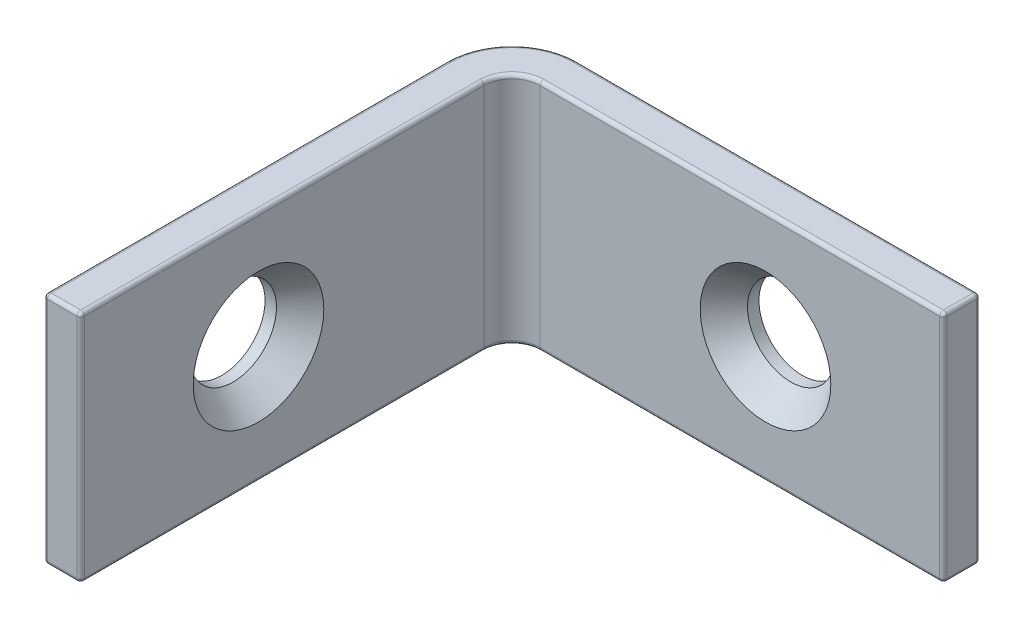
from build123d import *

# Parameters (mm, degrees)
BOSS_EXTRUDE1_DEPTH = 6.35
FILLET1_R           = 1.524
FILLET2_R           = 3.5179
CUT_EXTRUDE1_REACH  = 36.405
SKETCH4_R           = 2.3495
CUT_EXTRUDE3_REACH  = 36.405
SKETCH6_R           = 2.3495
FILLET3_R           = 0.19939


with BuildPart() as part:
    # Sketch3 → Boss-Extrude1 (new, symmetric)
    with BuildSketch(Plane(origin=(0, 0, 0), x_dir=(1, 0, 0), z_dir=(0, 1, 0))):
        Polygon((0.99695, -24.40305), (-0.99695, -24.40305), (-0.99695, 0.99695), (24.40305, 0.99695), (24.40305, -0.99695), (0.99695, -0.99695), align=None)
    extrude(amount=BOSS_EXTRUDE1_DEPTH, both=True)

    # Fillet1
    fillet1_edges = [part.edges().sort_by_distance(p)[0] for p in [
        (0.99695, 0, 0.99695),
    ]]
    fillet(fillet1_edges, radius=FILLET1_R)

    # Fillet2
    fillet2_edges = [part.edges().sort_by_distance(p)[0] for p in [
        (-0.99695, 0, -0.99695),
    ]]
    fillet(fillet2_edges, radius=FILLET2_R)

    # Sketch4 → Cut-Extrude1 (cut, up to next)
    with BuildSketch(Plane.XY.offset(0.99695), mode=Mode.PRIVATE) as cut_extrude1_sk1:
        with Locations((14.75105, 0)):
            Circle(SKETCH4_R)
    cut_extrude1_tool1 = extrude(cut_extrude1_sk1.sketch, amount=-CUT_EXTRUDE1_REACH, mode=Mode.PRIVATE) & part.part
    add(cut_extrude1_tool1.solids().sort_by_distance((14.75105, 0, 0.99695))[0], mode=Mode.SUBTRACT)

    # Cut-Extrude2 cone 1 section (through the dimple's axis) → Cut-Extrude2 (revolve, cut)
    with BuildSketch(Plane(origin=(14.75105, 0, 0.99695), x_dir=(0, -1, 0), z_dir=(1, 0, 0))):
        Polygon((0, 0), (3.5433, 0), (0, 4.076100377), align=None)
    revolve(axis=Axis((14.75105, 0, 0.99695), (0, 0, -1)), mode=Mode.SUBTRACT)

    # Sketch6 → Cut-Extrude3 (cut, up to next)
    with BuildSketch(Plane(origin=(0.99695, 0, 0), x_dir=(0, 0, -1), z_dir=(1, 0, 0)), mode=Mode.PRIVATE) as cut_extrude3_sk1:
        with Locations((-14.75105, 0)):
            Circle(SKETCH6_R)
    cut_extrude3_tool1 = extrude(cut_extrude3_sk1.sketch, amount=-CUT_EXTRUDE3_REACH, mode=Mode.PRIVATE) & part.part
    add(cut_extrude3_tool1.solids().sort_by_distance((0.99695, 0, 14.75105))[0], mode=Mode.SUBTRACT)

    # Cut-Extrude4 cone 1 section (through the dimple's axis) → Cut-Extrude4 (revolve, cut)
    with BuildSketch(Plane(origin=(0.99695, 0, 14.75105), x_dir=(0, 0, -1), z_dir=(0, 1, 0))):
        Polygon((0, 0), (3.5433, 0), (0, 4.076100377), align=None)
    revolve(axis=Axis((0.99695, 0, 14.75105), (-1, 0, 0)), mode=Mode.SUBTRACT)

    # Fillet3
    fillet3_edges = [part.edges().sort_by_distance(p)[0] for p in [
        (0.99695, 6.35, 13.462),
        (24.40305, 0, -0.99695),
        (24.40305, 0, 0.99695),
        (0.99695, 0, 24.40305),
        (-0.99695, 0, 24.40305),
        (24.40305, 6.35, 0),
        (13.462, -6.35, 0.99695),
        (13.462, 6.35, 0.99695),
        (13.462, 6.35, -0.99695),
        (1.443319265, -6.35, 1.443319265),
        (1.443319265, 6.35, 1.443319265),
        (-0.99695, -6.35, 13.462),
        (-0.99695, 6.35, 13.462),
        (0.033419054, -6.35, 0.033419054),
        (0.033419054, 6.35, 0.033419054),
        (13.462, -6.35, -0.99695),
        (24.40305, -6.35, 0),
        (0, 6.35, 24.40305),
        (0.99695, -6.35, 13.462),
        (0, -6.35, 24.40305),
    ]]
    fillet(fillet3_edges, radius=FILLET3_R)


solid = part.part
